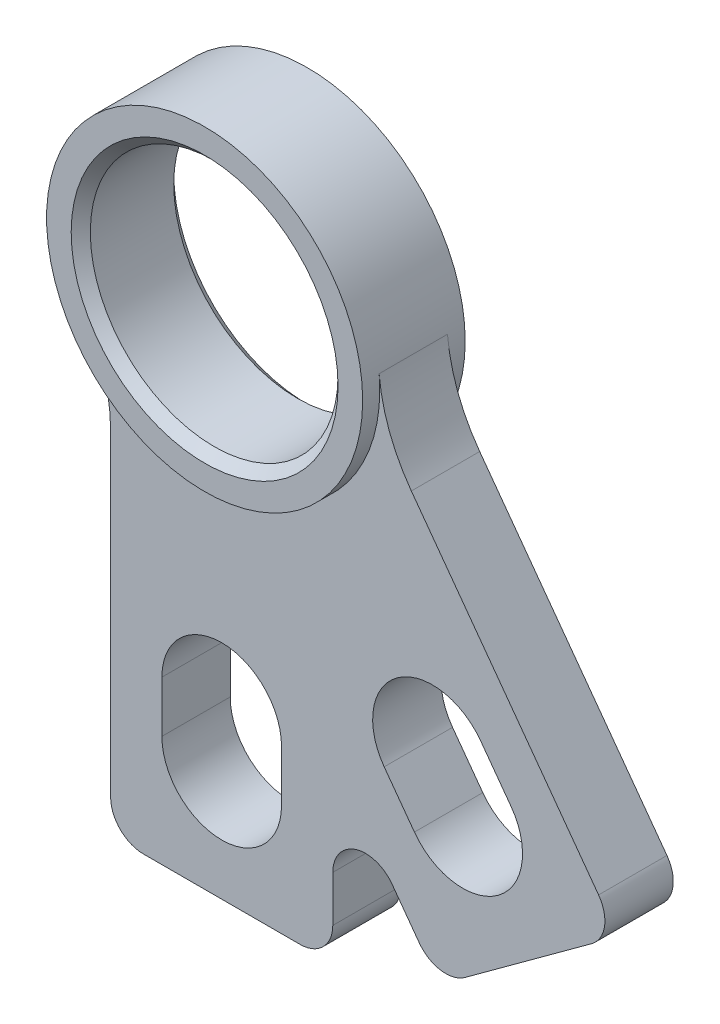
from build123d import *

# Parameters (mm, degrees)
SKETCH1_R           = 11.5062
BOSS_EXTRUDE2_DEPTH = 4.7625
BOSS_EXTRUDE3_DEPTH = 3.175
FILLET1_R           = 3.048
CHAMFER1_SIZE       = 0.889


with BuildPart() as part:
    # Sketch1 → Boss-Extrude2 (new, symmetric)
    with BuildSketch(Plane.XY):
        with BuildLine():
            ThreePointArc((14.621497696, 1.322663433), (-4.556441994, 13.956234084), (-12.585193267, -7.559797873))
            ThreePointArc((-12.585193267, -7.559797873), (4.556441994, -13.956234084), (14.621497696, 1.322663433))
        make_face()
        with Locations(Location((0, 0, 0), (0, 0, 180))):
            Circle(SKETCH1_R, mode=Mode.SUBTRACT)
    extrude(amount=BOSS_EXTRUDE2_DEPTH, both=True)

    # Sketch1<4> → Boss-Extrude3 (add, symmetric)
    with BuildSketch(Plane.XY):
        with BuildLine():
            ThreePointArc((-12.585193267, -7.559797873), (-10.89585042, -11.492870345), (-10.31875, -15.734319794))
            Line((-10.31875, -15.734319794), (-10.31875, -48.26))
            Line((-10.31875, -48.26), (10.31875, -48.26))
            Line((10.31875, -48.26), (10.31875, -31.605996662))
            Line((10.31875, -31.605996662), (20.145719857, -45.051683354))
            Line((20.145719857, -45.051683354), (36.80750102, -32.874185469))
            Line((36.80750102, -32.874185469), (17.615185966, -6.614426983))
            ThreePointArc((17.615185966, -6.614426983), (15.578373329, -2.849545496), (14.621497696, 1.322663433))
            ThreePointArc((14.621497696, 1.322663433), (4.556441994, -13.956234084), (-12.585193267, -7.559797873))
        make_face()
        with BuildLine():
            ThreePointArc((5.55625, -37.94125), (0, -43.4975), (-5.55625, -37.94125))
            Line((-5.55625, -37.94125), (-5.55625, -33.17875))
            ThreePointArc((-5.55625, -33.17875), (0, -27.6225), (5.55625, -33.17875))
            Line((5.55625, -33.17875), (5.55625, -37.94125))
        make_face(mode=Mode.SUBTRACT)
        with BuildLine():
            ThreePointArc((26.873725655, -27.353486707), (25.666418619, -35.117907989), (17.901997337, -33.910600953))
            Line((17.901997337, -33.910600953), (15.091805517, -30.065574531))
            ThreePointArc((15.091805517, -30.065574531), (16.299112553, -22.301153249), (24.063533835, -23.508460285))
            Line((24.063533835, -23.508460285), (26.873725655, -27.353486707))
        make_face(mode=Mode.SUBTRACT)
    extrude(amount=BOSS_EXTRUDE3_DEPTH, both=True)

    # Fillet1
    fillet1_edges = [part.edges().sort_by_distance(p)[0] for p in [
        (-10.31875, -48.26, 0),
        (10.31875, -48.26, 0),
        (10.31875, -31.605996662, 0),
        (20.145719857, -45.051683354, 0),
        (36.80750102, -32.874185469, 0),
    ]]
    fillet(fillet1_edges, radius=FILLET1_R)

    # Chamfer1
    chamfer1_edges = [part.edges().sort_by_distance(p)[0] for p in [
        (11.5062, 0, -4.7625),
        (11.5062, 0, 4.7625),
    ]]
    chamfer(chamfer1_edges, length=CHAMFER1_SIZE)


solid = part.part
